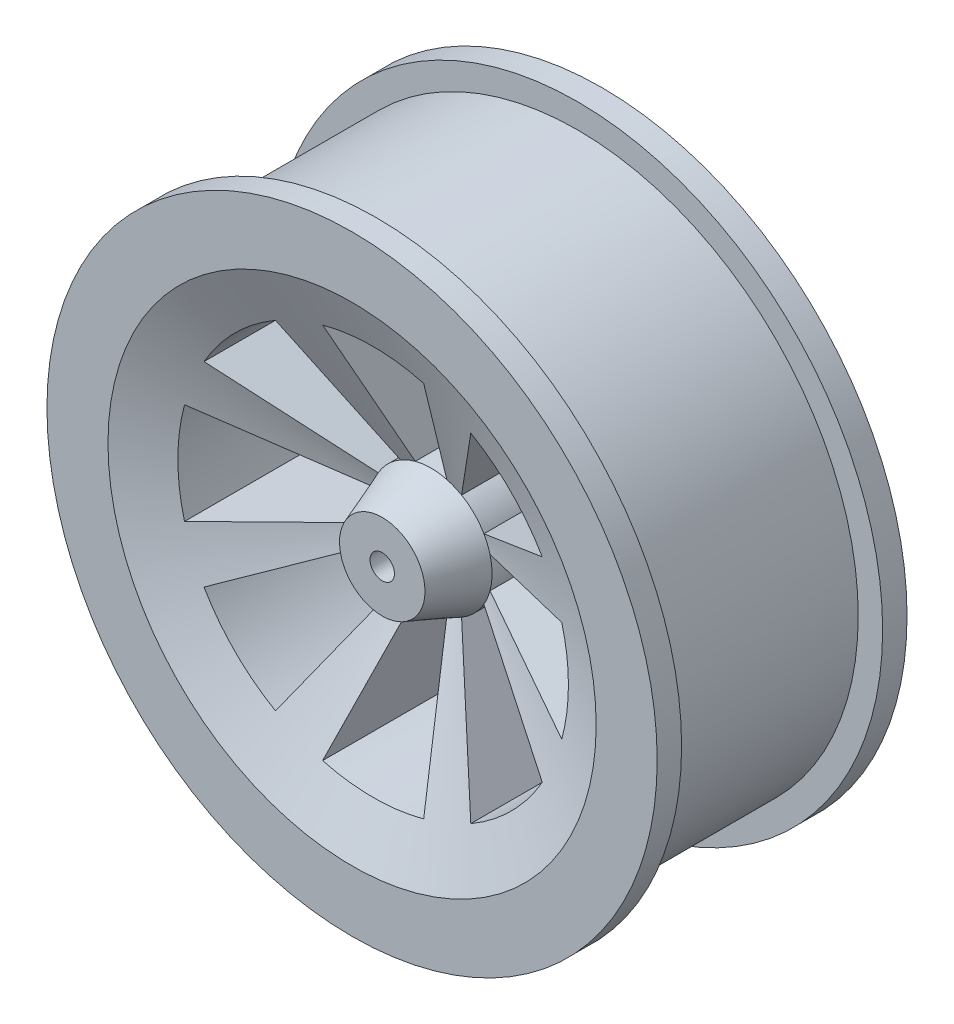
from build123d import *

# Parameters (mm, degrees)
CUT_EXTRUDE1_REACH = 53.886
CIRPATTERN1_COUNT  = 8


with BuildPart() as part:
    # Sketch1 → Revolve1 (revolve)
    with BuildSketch(Plane(origin=(0, 0, 0), x_dir=(0, 0, -1), z_dir=(1, 0, 0)), mode=Mode.PRIVATE) as revolve1_sk:
        Polygon((-8.89, 1.27), (3.81, 1.27), (3.81, 6.35), (13.97, 25.4), (13.97, 31.75), (11.43, 31.75), (11.43, 29.21), (-9.49, 29.21), (-9.49, 31.75), (-12.03, 31.75), (-12.03, 25.4), (-3.81, 6.35), (-8.89, 4.445), align=None)
    revolve(revolve1_sk.sketch.rotate(Axis((0, 0, 0), (0, 0, -1)), 90), axis=Axis((0, 0, 0), (0, 0, -1)))

    # Cut-Extrude1: up to this cone (the profile starts outside it)
    cut_extrude1_end = Plane(origin=(0, 0, 12.03), z_dir=(0, 0, -1)).offset(12.453334333) * Cone(1.875e-06, 78.62375, 41.932665667, align=(Align.CENTER, Align.CENTER, Align.MIN), mode=Mode.PRIVATE)
    # Sketch2 → Cut-Extrude1 (cut, up to the surface)
    with BuildSketch(Plane.XY.offset(12.03), mode=Mode.PRIVATE) as cut_extrude1_sk1:
        with BuildLine():
            Line((-5.259202996, 19.62761279), (-1.643500936, 6.133628997))
            ThreePointArc((-1.643500936, 6.133628997), (0, 6.35), (1.643500936, 6.133628997))
            Line((1.643500936, 6.133628997), (5.259202996, 19.62761279))
            ThreePointArc((5.259202996, 19.62761279), (0, 20.32), (-5.259202996, 19.62761279))
        make_face()
    cut_extrude1_tool1 = extrude(cut_extrude1_sk1.sketch, amount=-CUT_EXTRUDE1_REACH, mode=Mode.PRIVATE) - cut_extrude1_end
    cut_extrude1 = cut_extrude1_tool1.solids().sort_by_distance((0, 14.388913, 12.03))[0]
    add(cut_extrude1, mode=Mode.SUBTRACT)

    # CirPattern1: Cut-Extrude1 ×8 about axis
    cirpattern1_axis = Axis((0, 0, 0), (0, 0, 1))
    for i in range(1, CIRPATTERN1_COUNT):
        add(cut_extrude1.rotate(cirpattern1_axis, i * 360 / CIRPATTERN1_COUNT), mode=Mode.SUBTRACT)


solid = part.part
